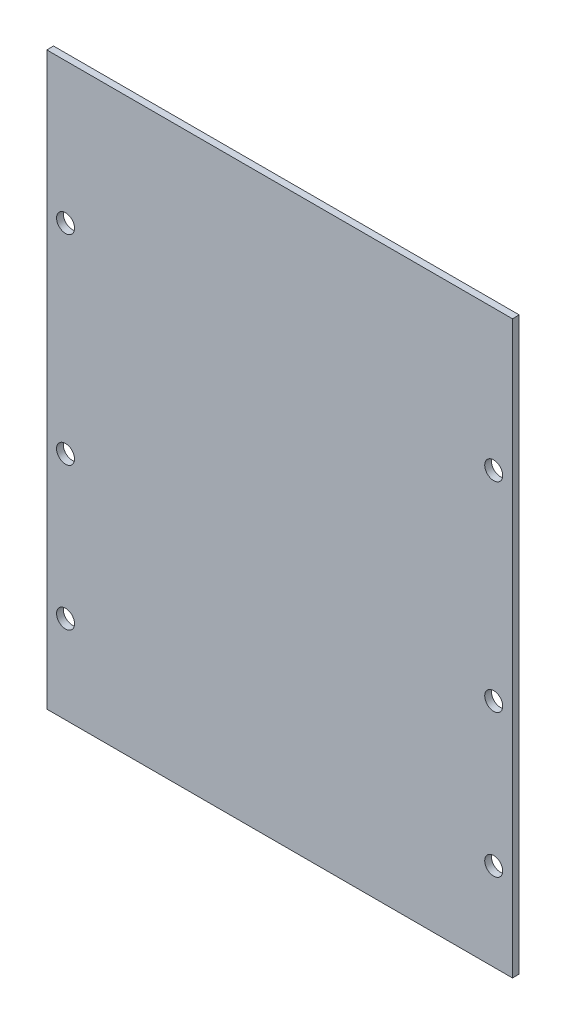
from build123d import *

# Parameters (mm, degrees)
SKETCH1_W           = 127
SKETCH1_H           = 103.6
SKETCH1_R           = 2
BOSS_EXTRUDE1_DEPTH = 1.5


with BuildPart() as part:
    # Sketch1 → Boss-Extrude1 (new body)
    with BuildSketch(Plane(origin=(0, 0, 0), x_dir=(0, 1, 0), z_dir=(0, 0, 1))):
        Rectangle(SKETCH1_W, SKETCH1_H)
        with Locations(Location((-43.98, 47.625, 0), (0, 0, 270))):
            Circle(SKETCH1_R, mode=Mode.SUBTRACT)
        with Locations(Location((-12.23, 47.625, 0), (0, 0, 270))):
            Circle(SKETCH1_R, mode=Mode.SUBTRACT)
        with Locations(Location((32.22, 47.625, 0), (0, 0, 270))):
            Circle(SKETCH1_R, mode=Mode.SUBTRACT)
        with Locations(Location((-43.98, -47.625, 0), (0, 0, 270))):
            Circle(SKETCH1_R, mode=Mode.SUBTRACT)
        with Locations(Location((-12.23, -47.625, 0), (0, 0, 270))):
            Circle(SKETCH1_R, mode=Mode.SUBTRACT)
        with Locations(Location((32.22, -47.625, 0), (0, 0, 270))):
            Circle(SKETCH1_R, mode=Mode.SUBTRACT)
    extrude(amount=BOSS_EXTRUDE1_DEPTH)


solid = part.part
